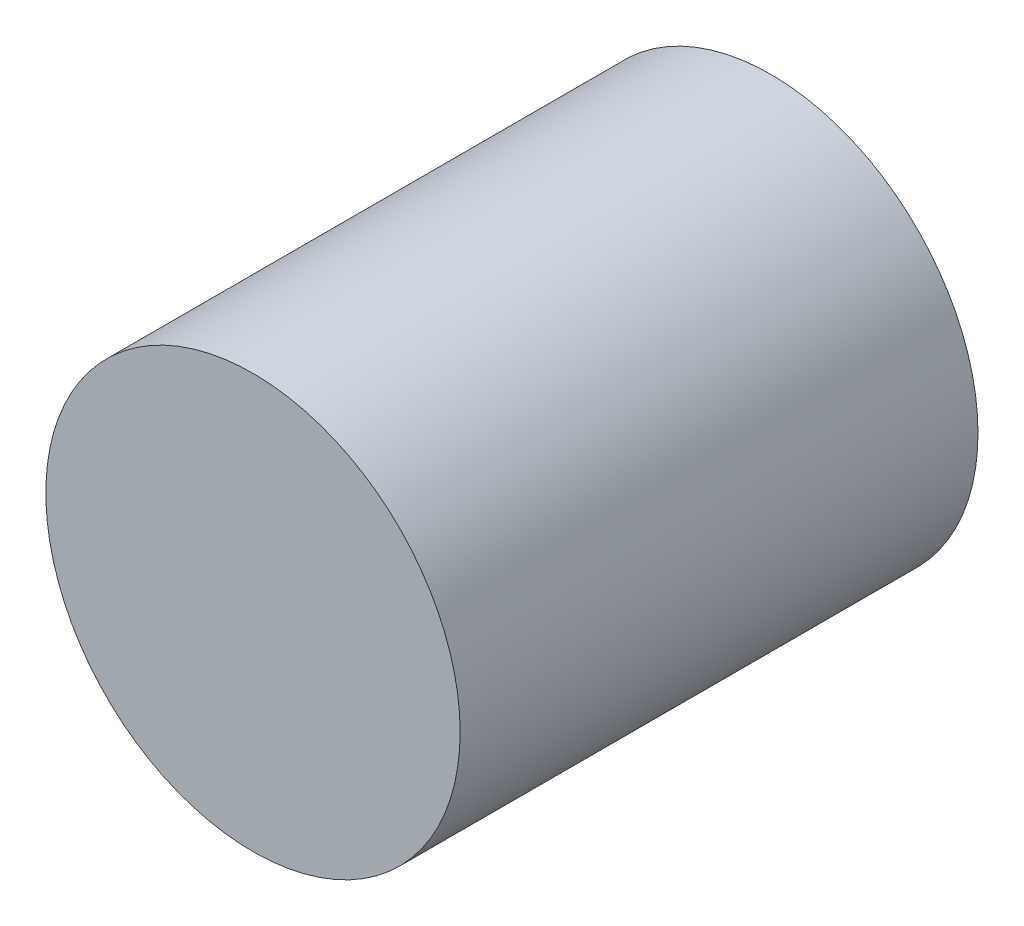
from build123d import *

# Parameters (mm, degrees)
SKETCH1_R           = 6
ROLLEREXTRUDE_DEPTH = 15


with BuildPart() as part:
    # Sketch1 → RollerExtrude (new body)
    with BuildSketch(Plane.XY):
        Circle(SKETCH1_R)
    extrude(amount=ROLLEREXTRUDE_DEPTH)


solid = part.part
